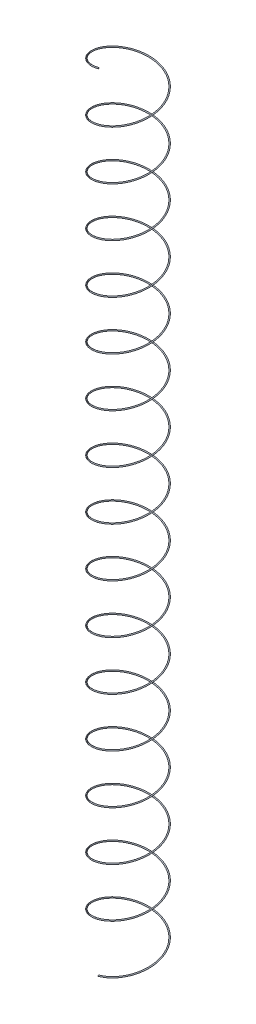
from build123d import *

# Parameters (mm, degrees)
DEPLOYED_PITCH  = 38
DEPLOYED_HEIGHT = 608
DEPLOYED_RADIUS = 22.75
SKETCH7_R       = 0.405


with BuildPart() as part:
    # Deployed: sweep along a helix
    with BuildLine() as deployed_path:
        Helix(DEPLOYED_PITCH, DEPLOYED_HEIGHT, DEPLOYED_RADIUS, center=(0, 0, 0), direction=(0, 1, 0))
    # Sketch7 → Deployed (sweep)
    with BuildSketch(Plane(origin=(0, 0, 0), x_dir=(0, 0, -1), z_dir=(1, 0, 0))):
        with Locations((-22.75, 0)):
            Circle(SKETCH7_R)
    sweep(path=deployed_path.line, is_frenet=True)


solid = part.part
